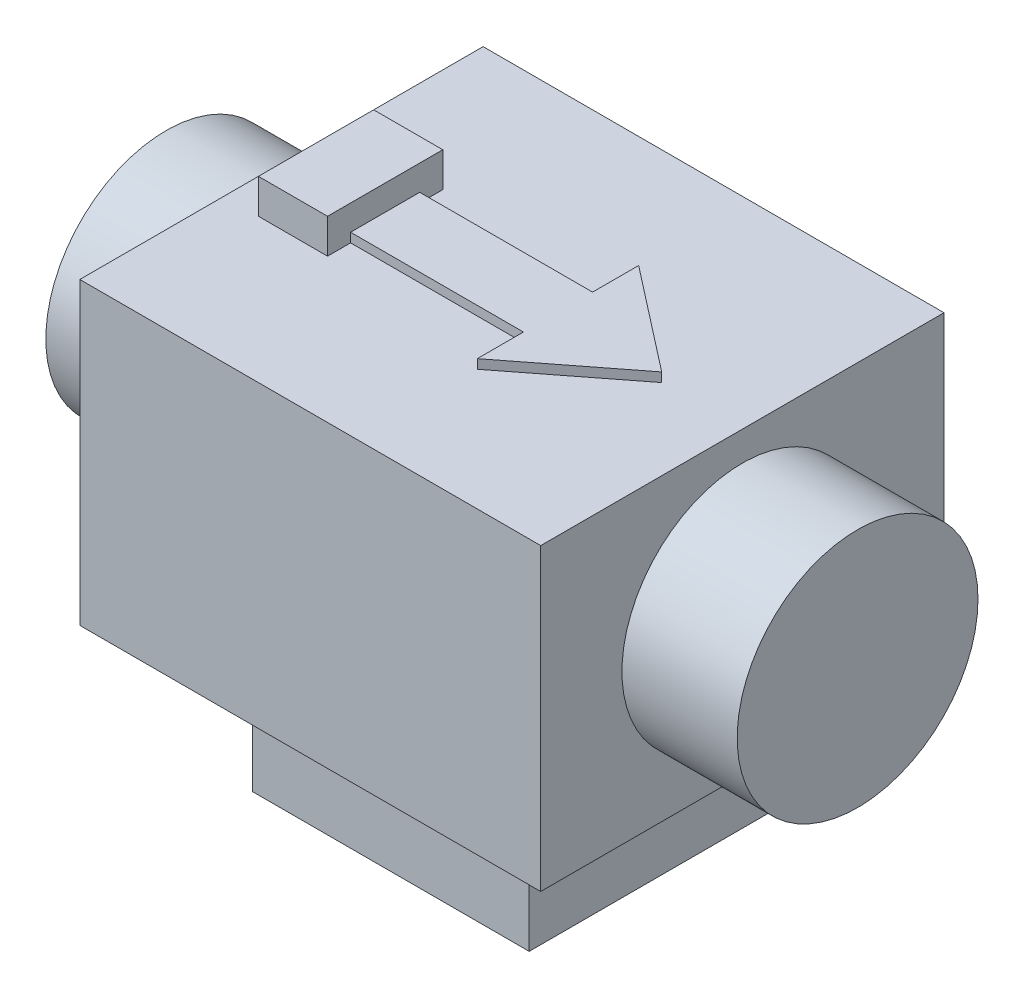
from build123d import *

# Parameters (mm, degrees)
BODY_START         = 12
SKETCH1_W          = 40
SKETCH1_H          = 35
BODY_DEPTH         = 26
PORT_IN_G12_START  = -30
SKETCH2_R          = 10.45
PORT_IN_G12_DEPTH  = 10
PORT_OUT_G12_START = 20
SKETCH3_R          = 10.45
PORT_OUT_G12_DEPTH = 10
SKETCH4_W          = 24
SKETCH4_H          = 21
FEET_DEPTH         = 12
FLOW_ARROW_START   = 38
FLOW_ARROW_DEPTH   = 0.8
WIRE_EXIT_START    = 38
SKETCH6_W          = 6
SKETCH6_H          = 10
WIRE_EXIT_DEPTH    = 3


with BuildPart() as part:
    # Sketch1 → Body (new body)
    with BuildSketch(Plane(origin=(0, 0, 0), x_dir=(1, 0, 0), z_dir=(0, 1, 0)).offset(BODY_START)):
        Rectangle(SKETCH1_W, SKETCH1_H)
    extrude(amount=BODY_DEPTH)

    # Sketch2 → Port_In_G12 (add)
    with BuildSketch(Plane(origin=(0, 0, 0), x_dir=(0, 0, -1), z_dir=(1, 0, 0)).offset(PORT_IN_G12_START)):
        with Locations((0, 25)):
            Circle(SKETCH2_R)
    extrude(amount=PORT_IN_G12_DEPTH)

    # Sketch3 → Port_Out_G12 (add)
    with BuildSketch(Plane(origin=(0, 0, 0), x_dir=(0, 0, -1), z_dir=(1, 0, 0)).offset(PORT_OUT_G12_START)):
        with Locations((0, 25)):
            Circle(SKETCH3_R)
    extrude(amount=PORT_OUT_G12_DEPTH)

    # Sketch4 → Feet (add)
    with BuildSketch(Plane(origin=(0, 0, 0), x_dir=(1, 0, 0), z_dir=(0, 1, 0))):
        Rectangle(SKETCH4_W, SKETCH4_H)
    extrude(amount=FEET_DEPTH)

    # Sketch5 → Flow_Arrow (add)
    with BuildSketch(Plane(origin=(0, 0, 0), x_dir=(1, 0, 0), z_dir=(0, 1, 0)).offset(FLOW_ARROW_START)):
        Polygon((-12, 3), (4, 3), (4, 7), (13, 0), (4, -7), (4, -3), (-12, -3), align=None)
    extrude(amount=FLOW_ARROW_DEPTH)

    # Sketch6 → Wire_Exit (add)
    with BuildSketch(Plane(origin=(0, 0, 0), x_dir=(1, 0, 0), z_dir=(0, 1, 0)).offset(WIRE_EXIT_START)):
        with Locations((-14, 0)):
            Rectangle(SKETCH6_W, SKETCH6_H)
    extrude(amount=WIRE_EXIT_DEPTH)


solid = part.part
